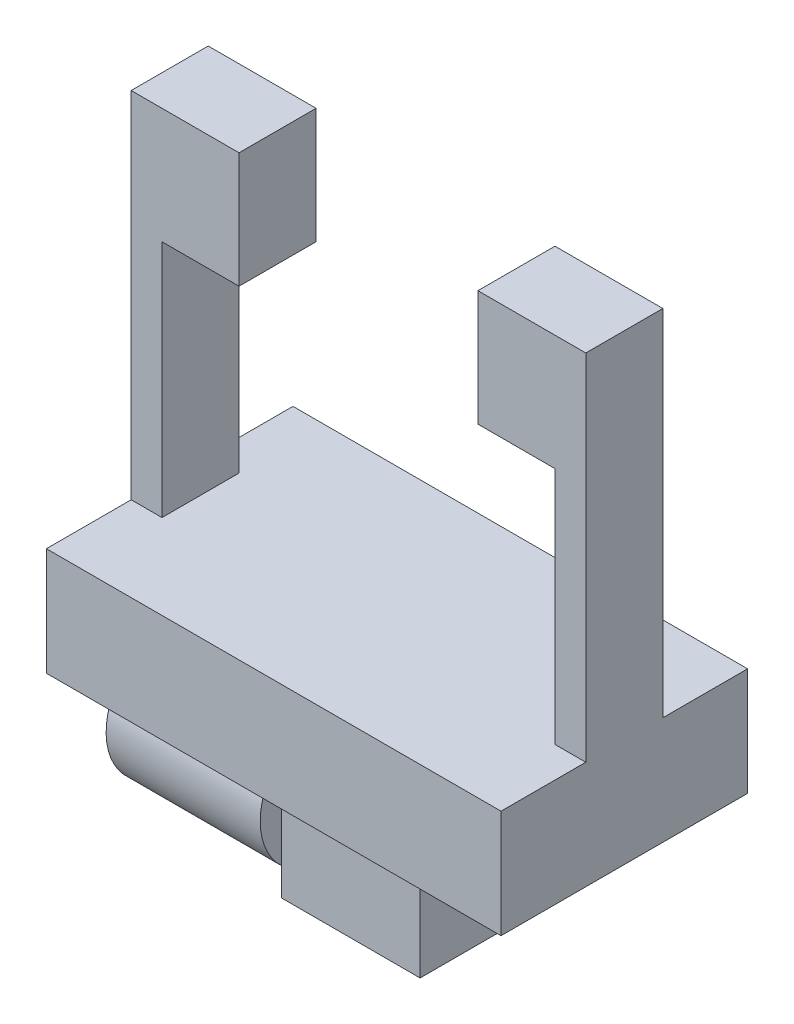
from build123d import *

# Parameters (mm, degrees)
SKETCH1_W           = 74.93
SKETCH1_H           = 17.78
BOSS_EXTRUDE1_DEPTH = 20.32
SKETCH2_W           = 5.08
SKETCH2_H           = 39.37
BOSS_EXTRUDE2_DEPTH = 6.35
SKETCH3_W           = 17.78
SKETCH3_H           = 19.05
BOSS_EXTRUDE3_DEPTH = 6.35
SKETCH5_W           = 22.86
SKETCH5_H           = 25.4
BOSS_EXTRUDE4_DEPTH = 7.62
SKETCH6_R           = 11.1125
BOSS_EXTRUDE5_DEPTH = 25.4


with BuildPart() as part:
    # Sketch1 → Boss-Extrude1 (new, symmetric)
    with BuildSketch(Plane.XY):
        Rectangle(SKETCH1_W, SKETCH1_H)
    extrude(amount=BOSS_EXTRUDE1_DEPTH, both=True)

    # Sketch2 → Boss-Extrude2 (add, symmetric)
    with BuildSketch(Plane.XY):
        with Locations((-34.925, 28.575)):
            Rectangle(SKETCH2_W, SKETCH2_H)
        with Locations((34.925, 28.575)):
            Rectangle(SKETCH2_W, SKETCH2_H)
    extrude(amount=BOSS_EXTRUDE2_DEPTH, both=True)

    # Sketch3 → Boss-Extrude3 (add, symmetric)
    with BuildSketch(Plane.XY):
        with Locations((28.575, 57.785)):
            Rectangle(SKETCH3_W, SKETCH3_H)
        with Locations((-28.575, 57.785)):
            Rectangle(SKETCH3_W, SKETCH3_H)
    extrude(amount=BOSS_EXTRUDE3_DEPTH, both=True)

    # Sketch5 → Boss-Extrude4 (add, symmetric)
    with BuildSketch(Plane.XY):
        with Locations((0, -21.59)):
            Rectangle(SKETCH5_W, SKETCH5_H)
    extrude(amount=BOSS_EXTRUDE4_DEPTH, both=True)

    # Sketch6 → Boss-Extrude5 (add)
    with BuildSketch(Plane.ZY.offset(11.43)):
        with Locations(Location((0, -21.59, 0), (0, 0, 46.708192407))):
            Circle(SKETCH6_R)
    extrude(amount=BOSS_EXTRUDE5_DEPTH)


solid = part.part
